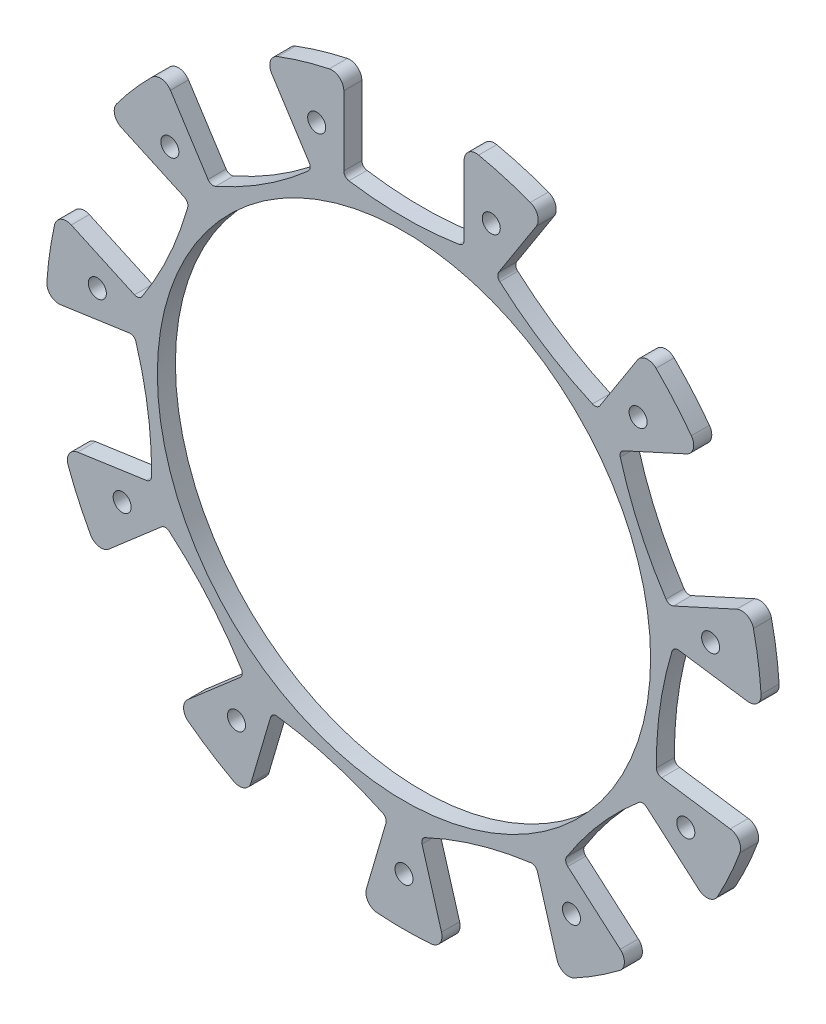
from build123d import *

# Parameters (mm, degrees)
SKETCH_2_R      = 41
SKETCH_2_R_2    = 1.5
EXTRUDE_1_DEPTH = 3
FILLET_1_R      = 1
FILLET_2_R      = 2


with BuildPart() as part:
    # 草图2 → 凸台-拉伸1 (new body)
    with BuildSketch(Plane.XY):
        with BuildLine():
            Line((10, 58.653644388), (10, 43.839202169))
            ThreePointArc((10, 43.839202169), (0, 43), (-10, 43.839202169))
            Line((-10, 43.839202169), (-10, 58.653644388))
            ThreePointArc((-10, 58.653644388), (-16.763087132, 57.08983193), (-23.29801892, 54.748993729))
            Line((-23.29801892, 54.748993729), (-15.288726769, 42.286291876))
            ThreePointArc((-15.288726769, 42.286291876), (-23.247555151, 36.173901912), (-32.113797426, 31.473475527))
            Line((-32.113797426, 31.473475527), (-40.123089577, 43.93617738))
            ThreePointArc((-40.123089577, 43.93617738), (-44.967099674, 38.96421367), (-49.199081449, 33.4619244))
            Line((-49.199081449, 33.4619244), (-35.723390814, 27.307782693))
            ThreePointArc((-35.723390814, 27.307782693), (-39.1141758, 17.862845559), (-44.031691074, 9.115142785))
            Line((-44.031691074, 9.115142785), (-57.50738171, 15.269284493))
            ThreePointArc((-57.50738171, 15.269284493), (-58.894375792, 8.467732877), (-59.479783242, 1.550930504))
            Line((-59.479783242, 1.550930504), (-44.816130685, 3.659245452))
            ThreePointArc((-44.816130685, 3.659245452), (-42.562322001, -6.119538046), (-41.969833919, -16.137183386))
            Line((-41.969833919, -16.137183386), (-56.633486477, -18.245498334))
            ThreePointArc((-56.633486477, -18.245498334), (-54.123103724, -24.717193274), (-50.87607412, -30.852472869))
            Line((-50.87607412, -30.852472869), (-39.680065719, -21.151076364))
            ThreePointArc((-39.680065719, -21.151076364), (-32.497231697, -28.15901156), (-26.58285104, -36.266067852))
            Line((-26.58285104, -36.266067852), (-37.778859441, -45.967464356))
            ThreePointArc((-37.778859441, -45.967464356), (-32.168128639, -50.054585203), (-26.119570938, -53.460434099))
            Line((-26.119570938, -53.460434099), (-21.945860253, -39.246080882))
            ThreePointArc((-21.945860253, -39.246080882), (-12.114499944, -41.258197865), (-2.756000781, -44.880732018))
            Line((-2.756000781, -44.880732018), (-6.929711465, -59.095085236))
            ThreePointArc((-6.929711465, -59.095085236), (0, -59.5), (6.929711465, -59.095085236))
            Line((6.929711465, -59.095085236), (2.756000781, -44.880732018))
            ThreePointArc((2.756000781, -44.880732018), (12.114499944, -41.258197865), (21.945860253, -39.246080882))
            Line((21.945860253, -39.246080882), (26.119570938, -53.460434099))
            ThreePointArc((26.119570938, -53.460434099), (32.168128639, -50.054585203), (37.778859441, -45.967464356))
            Line((37.778859441, -45.967464356), (26.58285104, -36.266067852))
            ThreePointArc((26.58285104, -36.266067852), (32.497231697, -28.15901156), (39.680065719, -21.151076364))
            Line((39.680065719, -21.151076364), (50.87607412, -30.852472869))
            ThreePointArc((50.87607412, -30.852472869), (54.123103724, -24.717193274), (56.633486477, -18.245498334))
            Line((56.633486477, -18.245498334), (41.969833919, -16.137183386))
            ThreePointArc((41.969833919, -16.137183386), (42.562322001, -6.119538046), (44.816130685, 3.659245452))
            Line((44.816130685, 3.659245452), (59.479783242, 1.550930504))
            ThreePointArc((59.479783242, 1.550930504), (58.894375792, 8.467732877), (57.50738171, 15.269284493))
            Line((57.50738171, 15.269284493), (44.031691074, 9.115142785))
            ThreePointArc((44.031691074, 9.115142785), (39.1141758, 17.862845559), (35.723390814, 27.307782693))
            Line((35.723390814, 27.307782693), (49.199081449, 33.4619244))
            ThreePointArc((49.199081449, 33.4619244), (44.967099674, 38.96421367), (40.123089577, 43.93617738))
            Line((40.123089577, 43.93617738), (32.113797426, 31.473475527))
            ThreePointArc((32.113797426, 31.473475527), (23.247555151, 36.173901912), (15.288726769, 42.286291876))
            Line((15.288726769, 42.286291876), (23.29801892, 54.748993729))
            ThreePointArc((23.29801892, 54.748993729), (16.763087132, 57.08983193), (10, 58.653644388))
        make_face()
        Circle(SKETCH_2_R, mode=Mode.SUBTRACT)
        with Locations((0, -51.5)):
            Circle(SKETCH_2_R_2, mode=Mode.SUBTRACT)
        with Locations((-27.843002099, -43.324556941)):
            Circle(SKETCH_2_R_2, mode=Mode.SUBTRACT)
        with Locations((-46.846047761, -21.39387317)):
            Circle(SKETCH_2_R_2, mode=Mode.SUBTRACT)
        with Locations((-50.975804257, 7.329214171)):
            Circle(SKETCH_2_R_2, mode=Mode.SUBTRACT)
        with Locations((-38.921103079, 33.725327798)):
            Circle(SKETCH_2_R_2, mode=Mode.SUBTRACT)
        with Locations((-14.509226677, 49.413888141)):
            Circle(SKETCH_2_R_2, mode=Mode.SUBTRACT)
        with Locations((14.509226677, 49.413888141)):
            Circle(SKETCH_2_R_2, mode=Mode.SUBTRACT)
        with Locations((38.921103079, 33.725327798)):
            Circle(SKETCH_2_R_2, mode=Mode.SUBTRACT)
        with Locations((50.975804257, 7.329214171)):
            Circle(SKETCH_2_R_2, mode=Mode.SUBTRACT)
        with Locations((46.846047761, -21.39387317)):
            Circle(SKETCH_2_R_2, mode=Mode.SUBTRACT)
        with Locations((27.843002099, -43.324556941)):
            Circle(SKETCH_2_R_2, mode=Mode.SUBTRACT)
    extrude(amount=EXTRUDE_1_DEPTH)

    # 圆角1
    fillet_1_edges = [part.edges().sort_by_distance(p)[0] for p in [
        (10, 43.839202169, 1.5),
        (-10, 43.839202169, 1.5),
        (-15.288726769, 42.286291876, 1.5),
        (-32.113797426, 31.473475527, 1.5),
        (-35.723390814, 27.307782693, 1.5),
        (-44.031691074, 9.115142785, 1.5),
        (-44.816130685, 3.659245452, 1.5),
        (-41.969833919, -16.137183386, 1.5),
        (-39.680065719, -21.151076364, 1.5),
        (-26.58285104, -36.266067852, 1.5),
        (-21.945860253, -39.246080882, 1.5),
        (-2.756000781, -44.880732018, 1.5),
        (2.756000781, -44.880732018, 1.5),
        (21.945860253, -39.246080882, 1.5),
        (26.58285104, -36.266067852, 1.5),
        (39.680065719, -21.151076364, 1.5),
        (41.969833919, -16.137183386, 1.5),
        (44.816130685, 3.659245452, 1.5),
        (44.031691074, 9.115142785, 1.5),
        (35.723390814, 27.307782693, 1.5),
        (32.113797426, 31.473475527, 1.5),
        (15.288726769, 42.286291876, 1.5),
    ]]
    fillet(fillet_1_edges, radius=FILLET_1_R)

    # 圆角2
    fillet_2_edges = [part.edges().sort_by_distance(p)[0] for p in [
        (10, 58.653644388, 1.5),
        (-10, 58.653644388, 1.5),
        (-23.29801892, 54.748993729, 1.5),
        (-40.123089577, 43.93617738, 1.5),
        (-49.199081449, 33.4619244, 1.5),
        (-57.50738171, 15.269284493, 1.5),
        (-59.479783242, 1.550930504, 1.5),
        (-56.633486477, -18.245498334, 1.5),
        (-50.87607412, -30.852472869, 1.5),
        (-37.778859441, -45.967464356, 1.5),
        (-26.119570938, -53.460434099, 1.5),
        (-6.929711465, -59.095085236, 1.5),
        (6.929711465, -59.095085236, 1.5),
        (26.119570938, -53.460434099, 1.5),
        (37.778859441, -45.967464356, 1.5),
        (50.87607412, -30.852472869, 1.5),
        (56.633486477, -18.245498334, 1.5),
        (59.479783242, 1.550930504, 1.5),
        (57.50738171, 15.269284493, 1.5),
        (49.199081449, 33.4619244, 1.5),
        (40.123089577, 43.93617738, 1.5),
        (23.29801892, 54.748993729, 1.5),
    ]]
    fillet(fillet_2_edges, radius=FILLET_2_R)


solid = part.part
